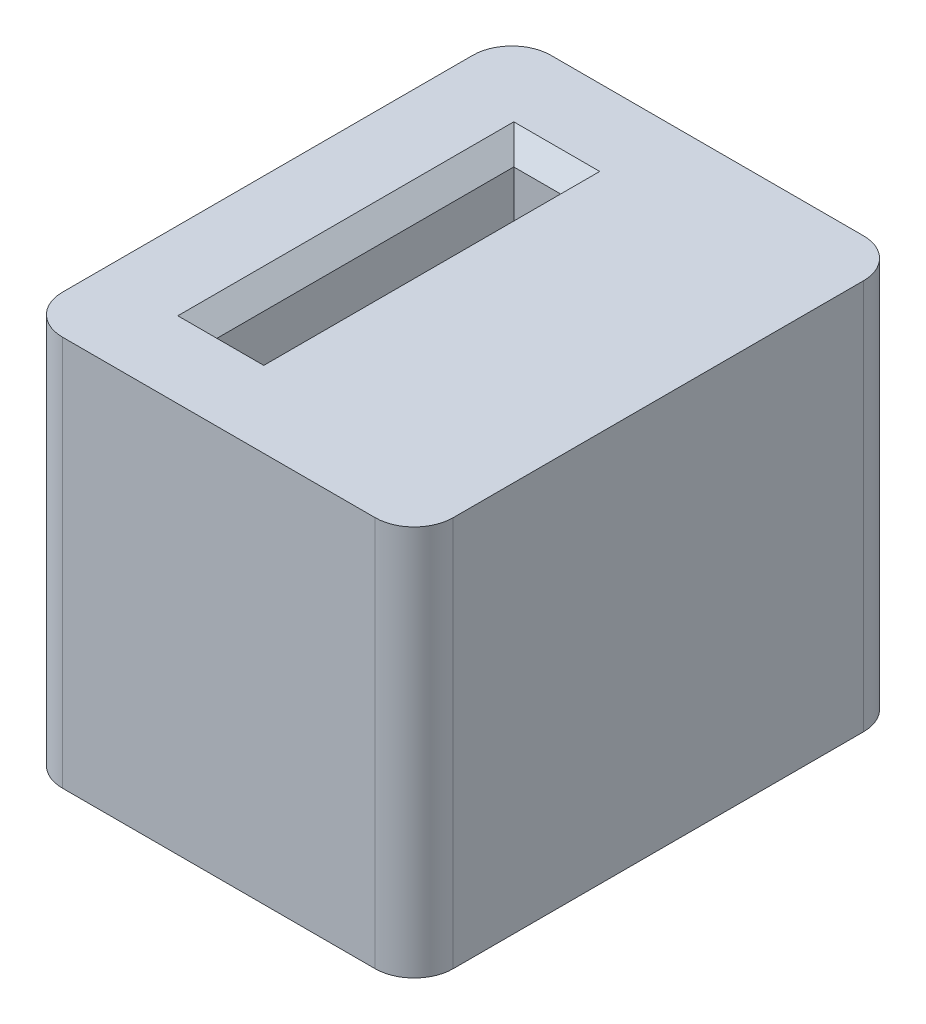
from build123d import *

# Parameters (mm, degrees)
SKETCH1_W           = 25.4
SKETCH1_H           = 31.75
BOSS_EXTRUDE1_DEPTH = 25.4
SKETCH2_W           = 3.048
SKETCH2_H           = 19.304
CUT_EXTRUDE1_DEPTH  = 33.534068682
FILLET1_R           = 2.54
CHAMFER1_SIZE       = 1.27


with BuildPart() as part:
    # Sketch1 → Boss-Extrude1 (new body)
    with BuildSketch(Plane(origin=(0, 0, 0), x_dir=(1, 0, 0), z_dir=(0, 1, 0))):
        Rectangle(SKETCH1_W, SKETCH1_H)
    extrude(amount=BOSS_EXTRUDE1_DEPTH)

    # Sketch2 → Cut-Extrude1 (cut, through all)
    with BuildSketch(Plane(origin=(0, 25.4, 0), x_dir=(1, 0, 0), z_dir=(0, 1, 0))):
        with Locations((-4.826, 0)):
            Rectangle(SKETCH2_W, SKETCH2_H)
    extrude(amount=-CUT_EXTRUDE1_DEPTH, mode=Mode.SUBTRACT)

    # Fillet1
    fillet1_edges = [part.edges().sort_by_distance(p)[0] for p in [
        (12.7, 12.7, 15.875),
        (-12.7, 12.7, 15.875),
        (-12.7, 12.7, -15.875),
        (12.7, 12.7, -15.875),
    ]]
    fillet(fillet1_edges, radius=FILLET1_R)

    # Chamfer1
    chamfer1_edges = [part.edges().sort_by_distance(p)[0] for p in [
        (-3.302, 0, 0),
        (-4.826, 0, 9.652),
        (-6.35, 0, 0),
        (-4.826, 0, -9.652),
        (-3.302, 25.4, 0),
        (-4.826, 25.4, -9.652),
        (-6.35, 25.4, 0),
        (-4.826, 25.4, 9.652),
    ]]
    chamfer(chamfer1_edges, length=CHAMFER1_SIZE)


solid = part.part
